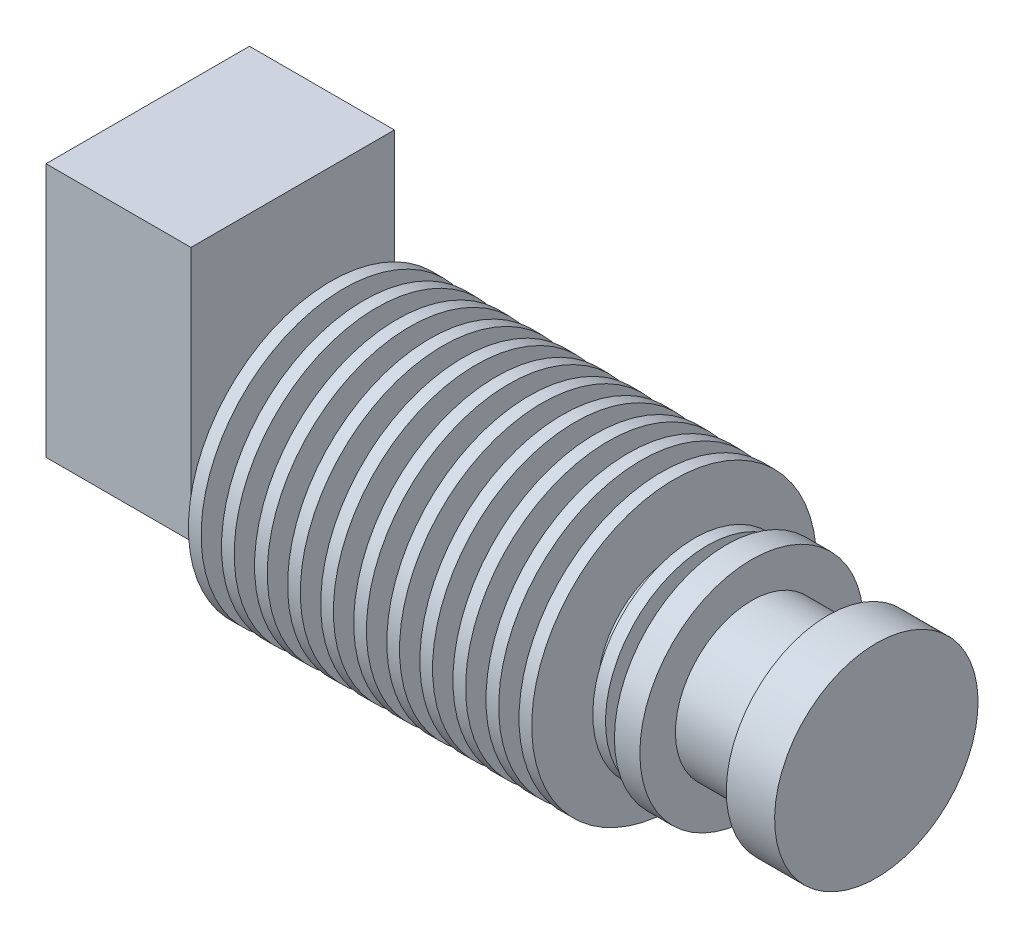
from build123d import *

# Parameters (mm, degrees)
SKETCH_3_R      = 3.5
EXTRUDE_1_DEPTH = 3
SKETCH_4_W      = 16
SKETCH_4_H      = 20
EXTRUDE_2_DEPTH = 11.4
EXTRUDE_3_DEPTH = 3
SKETCH_6_R      = 1.8
SKETCH_7_R      = 0.5


with BuildPart() as part:
    # 草圖1 → 旋轉1 (revolve)
    with BuildSketch(Plane.XY, mode=Mode.PRIVATE) as revolve_1_sk:
        Polygon((-26, 0), (-26, 11.2), (-25, 11.2), (-25, 6), (-23.4, 6), (-23.4, 11.2), (-22.4, 11.2), (-22.4, 6), (-20.8, 6), (-20.8, 11.2), (-19.8, 11.2), (-19.8, 6), (-18.2, 6), (-18.2, 11.2), (-17.2, 11.2), (-17.2, 6), (-15.6, 6), (-15.6, 11.2), (-14.6, 11.2), (-14.6, 6), (-13, 6), (-13, 11.2), (-12, 11.2), (-12, 6), (-10.4, 6), (-10.4, 11.2), (-9.4, 11.2), (-9.4, 6), (-7.8, 6), (-7.8, 11.2), (-6.8, 11.2), (-6.8, 6), (-5.2, 6), (-5.2, 11.2), (-4.2, 11.2), (-4.2, 6), (-2.6, 6), (-2.6, 11.2), (-1.6, 11.2), (-1.6, 6), (0, 6), (0, 11.2), (1, 11.2), (1, 6), (2.6, 6), (2.6, 0), (1, 0), (0, 0), align=None)
    revolve(revolve_1_sk.sketch.rotate(Axis((0, 0, 0), (-1, 0, 0)), 90), axis=Axis((0, 0, 0), (-1, 0, 0)))

    # 草圖2 → 旋轉2 (revolve)
    with BuildSketch(Plane.XY):
        Polygon((2.6, 0), (2.6, 8), (3.6, 8), (3.6, 6), (5.1, 6), (5.1, 8.79813536), (7.1, 8.79813536), (7.1, 6), (13.1, 6), (13.1, 8), (16.9, 8), (16.9, 0), align=None)
    revolve(axis=Axis((16.9, 0, 0), (-1, 0, 0)))

    # 草圖3 → 填料-伸長1 (add)
    with BuildSketch(Plane.ZY.offset(26)):
        Circle(SKETCH_3_R)
    extrude(amount=EXTRUDE_1_DEPTH)

    # 草圖4 → 填料-伸長2 (add)
    with BuildSketch(Plane.ZY.offset(29)):
        with Locations((0, 6)):
            Rectangle(SKETCH_4_W, SKETCH_4_H)
    extrude(amount=EXTRUDE_2_DEPTH)

    # 草圖5 → 填料-伸長3 (add)
    with BuildSketch(Plane.ZY.offset(40.4)):
        Polygon((4.041451884, 0), (2.020725942, 3.5), (-2.020725942, 3.5), (-4.041451884, 0), (-2.020725942, -3.5), (2.020725942, -3.5), align=None)
    extrude(amount=EXTRUDE_3_DEPTH)

    # 草圖6 → 疊層拉伸1 section 0
    with BuildSketch(Plane.ZY.offset(43.4)):
        Circle(SKETCH_6_R)
    # 草圖7 → 疊層拉伸1 section 1
    with BuildSketch(Plane.ZY.offset(45.4)):
        Circle(SKETCH_7_R)
    loft()


solid = part.part
